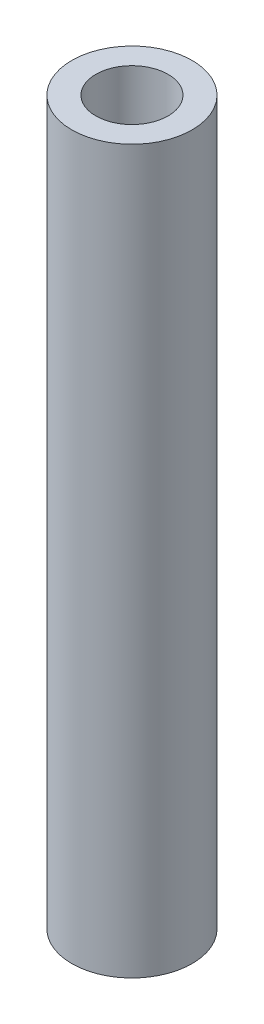
from build123d import *

# Parameters (mm, degrees)
SKETCH1_R           = 2.5
SKETCH1_R_2         = 1.5
BOSS_EXTRUDE1_DEPTH = 15


with BuildPart() as part:
    # Sketch1 → Boss-Extrude1 (new, symmetric)
    with BuildSketch(Plane(origin=(0, 0, 0), x_dir=(1, 0, 0), z_dir=(0, 1, 0))):
        with Locations(Location((0, 0, 0), (0, 0, 270))):
            Circle(SKETCH1_R)
        with Locations(Location((0, 0, 0), (0, 0, 270))):
            Circle(SKETCH1_R_2, mode=Mode.SUBTRACT)
    extrude(amount=BOSS_EXTRUDE1_DEPTH, both=True)


solid = part.part
